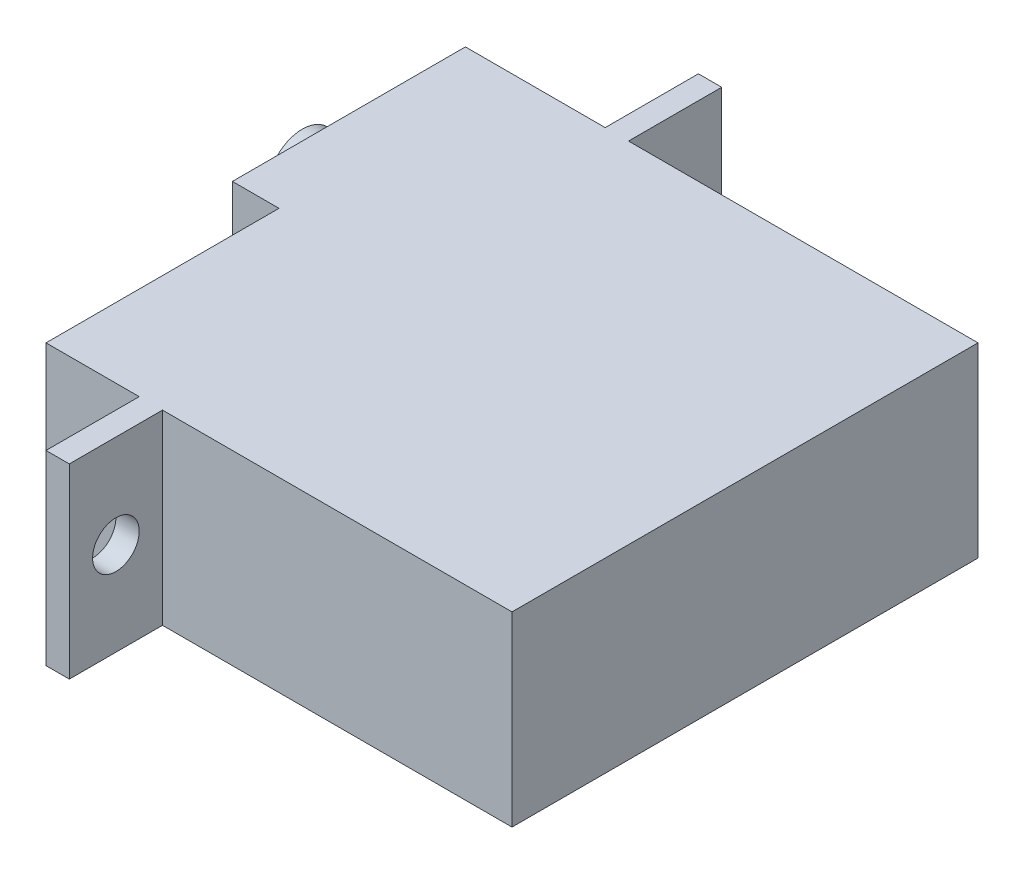
from build123d import *

# Parameters (mm, degrees)
SKETCH1_W           = 20
SKETCH1_H           = 20
BOSS_EXTRUDE1_DEPTH = 8
SKETCH2_W           = 1
SKETCH2_H           = 8
BOSS_EXTRUDE2_DEPTH = 4
SKETCH3_W           = 1
SKETCH3_H           = 8
BOSS_EXTRUDE3_DEPTH = 4
SKETCH4_R           = 1
CUT_EXTRUDE1_DEPTH  = 4
SKETCH5_W           = 10
SKETCH5_H           = 8
BOSS_EXTRUDE4_DEPTH = 2
SKETCH6_R           = 1.5
BOSS_EXTRUDE5_DEPTH = 3


with BuildPart() as part:
    # Sketch1 → Boss-Extrude1 (new body)
    with BuildSketch(Plane(origin=(0, 0, 0), x_dir=(1, 0, 0), z_dir=(0, 1, 0))):
        with Locations((10, -10)):
            Rectangle(SKETCH1_W, SKETCH1_H)
    extrude(amount=BOSS_EXTRUDE1_DEPTH)

    # Sketch2 → Boss-Extrude2 (add)
    with BuildSketch(Plane(origin=(0, 0, 0), x_dir=(-1, 0, 0), z_dir=(0, 0, -1))):
        with Locations((-4.5, 4)):
            Rectangle(SKETCH2_W, SKETCH2_H)
    extrude(amount=BOSS_EXTRUDE2_DEPTH)

    # Sketch3 → Boss-Extrude3 (add)
    with BuildSketch(Plane.XY.offset(20)):
        with Locations((4.5, 4)):
            Rectangle(SKETCH3_W, SKETCH3_H)
    extrude(amount=BOSS_EXTRUDE3_DEPTH)

    # Sketch4 → Cut-Extrude1 (cut)
    with BuildSketch(Plane.ZY.offset(-4)):
        with Locations(Location((-2, 4, 0), (0, 0, 270))):
            Circle(SKETCH4_R)
        with Locations(Location((22, 4, 0), (0, 0, 270))):
            Circle(SKETCH4_R)
    extrude(amount=-CUT_EXTRUDE1_DEPTH, mode=Mode.SUBTRACT)

    # Sketch5 → Boss-Extrude4 (add)
    with BuildSketch(Plane.ZY):
        with Locations((5, 4)):
            Rectangle(SKETCH5_W, SKETCH5_H)
    extrude(amount=BOSS_EXTRUDE4_DEPTH)

    # Sketch6 → Boss-Extrude5 (add)
    with BuildSketch(Plane.ZY.offset(2)):
        with Locations((4, 3.944627207)):
            Circle(SKETCH6_R)
    extrude(amount=BOSS_EXTRUDE5_DEPTH)


solid = part.part
